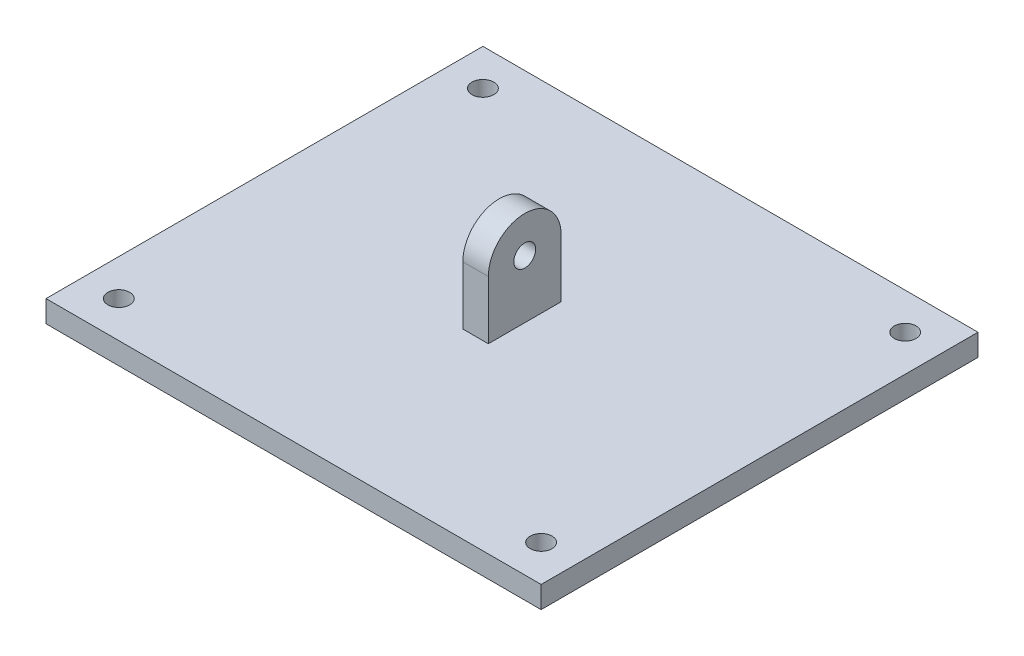
from build123d import *

# Parameters (mm, degrees)
CROQUIS1_W              = 68
CROQUIS1_H              = 60
CROQUIS1_R              = 1.5
SALIENTE_EXTRUIR2_DEPTH = 3
CROQUIS2_W              = 5
CROQUIS2_H              = 10
SALIENTE_EXTRUIR3_DEPTH = 13
CORTAR_EXTRUIR1_DEPTH   = 13
CROQUIS4_R              = 1.5
CORTAR_EXTRUIR2_DEPTH   = 13
CROQUIS6_W              = 0.75
CROQUIS6_H              = 19.11
CROQUIS6_H_2            = 18.27
CORTAR_EXTRUIR3_DEPTH   = 10


with BuildPart() as part:
    # Croquis1 → Saliente-Extruir2 (new body)
    with BuildSketch(Plane(origin=(0, 0, 0), x_dir=(1, 0, 0), z_dir=(0, 1, 0))):
        Rectangle(CROQUIS1_W, CROQUIS1_H)
        with Locations(Location((-29, 25, 0), (0, 0, 270))):
            Circle(CROQUIS1_R, mode=Mode.SUBTRACT)
        with Locations(Location((29, 25, 0), (0, 0, 270))):
            Circle(CROQUIS1_R, mode=Mode.SUBTRACT)
        with Locations(Location((-29, -25, 0), (0, 0, 270))):
            Circle(CROQUIS1_R, mode=Mode.SUBTRACT)
        with Locations(Location((29, -25, 0), (0, 0, 270))):
            Circle(CROQUIS1_R, mode=Mode.SUBTRACT)
    extrude(amount=SALIENTE_EXTRUIR2_DEPTH)

    # Croquis2 → Saliente-Extruir3 (add)
    with BuildSketch(Plane(origin=(0, 3, 0), x_dir=(1, 0, 0), z_dir=(0, 1, 0))):
        Rectangle(CROQUIS2_W, CROQUIS2_H)
    extrude(amount=SALIENTE_EXTRUIR3_DEPTH)

    # Croquis3 → Cortar-Extruir1 (cut)
    with BuildSketch(Plane(origin=(2.5, 0, 0), x_dir=(0, 0, -1), z_dir=(1, 0, 0))):
        with BuildLine():
            Line((-5, 16), (-5, 11))
            ThreePointArc((-5, 11), (-3.535533906, 14.535533906), (0, 16))
            Line((0, 16), (-5, 16))
        make_face()
        with BuildLine():
            ThreePointArc((0, 16), (3.535533906, 14.535533906), (5, 11))
            Line((5, 11), (5, 16))
            Line((5, 16), (0, 16))
        make_face()
    extrude(amount=-CORTAR_EXTRUIR1_DEPTH, mode=Mode.SUBTRACT)

    # Croquis4 → Cortar-Extruir2 (cut)
    with BuildSketch(Plane(origin=(2.5, 0, 0), x_dir=(0, 0, -1), z_dir=(1, 0, 0))):
        with Locations((0, 11)):
            Circle(CROQUIS4_R)
    extrude(amount=-CORTAR_EXTRUIR2_DEPTH, mode=Mode.SUBTRACT)

    # Croquis6 → Cortar-Extruir3 (cut)
    with BuildSketch(Plane(origin=(0, 0, -5), x_dir=(-1, 0, 0), z_dir=(0, 0, -1))):
        with Locations((-2.125, 12.555)):
            Rectangle(CROQUIS6_W, CROQUIS6_H)
        with Locations((2.125, 12.135)):
            Rectangle(CROQUIS6_W, CROQUIS6_H_2)
    extrude(amount=-CORTAR_EXTRUIR3_DEPTH, mode=Mode.SUBTRACT)


solid = part.part
